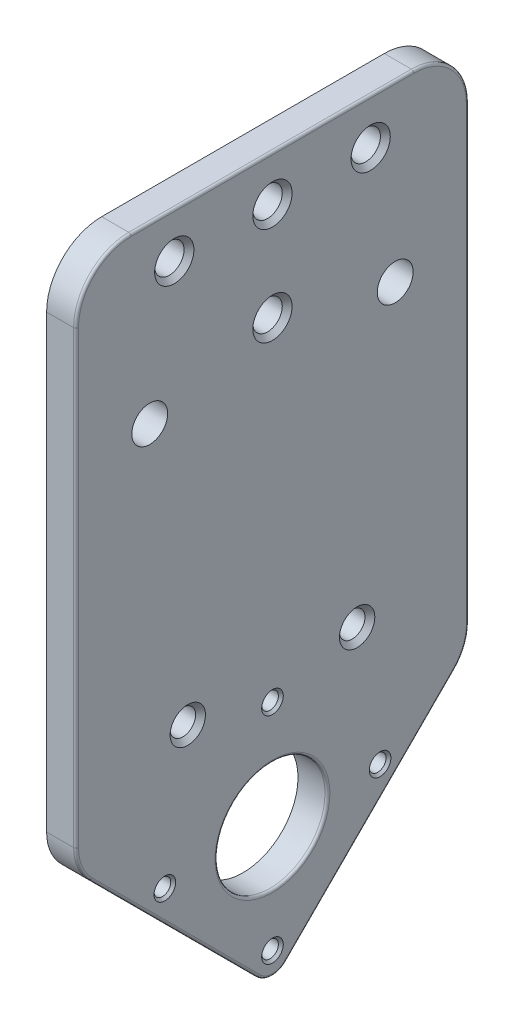
from build123d import *

# Parameters (mm, degrees)
SKETCH_2_R      = 1.7
SKETCH_2_R_2    = 2.6
SKETCH_2_R_3    = 11.2
SKETCH_2_R_4    = 3.655
SKETCH_2_R_5    = 3
EXTRUDE_1_DEPTH = 6
CHAMFER_1_SIZE  = 1
CHAMFER_2_SIZE  = 0.5
FILLET_1_R      = 0.5


with BuildPart() as part:
    # Эскиз2 → Бобышка-Вытянуть1 (new body)
    with BuildSketch(Plane(origin=(0, 0, 0), x_dir=(0, 0, -1), z_dir=(1, 0, 0))):
        with BuildLine():
            Line((-28.783294421, 72.542236653), (28.783294421, 72.542236653))
            ThreePointArc((28.783294421, 72.542236653), (36.714702999, 69.256939651), (40, 61.325531074))
            Line((40, 61.325531074), (40, -30.391408151))
            ThreePointArc((40, -30.391408151), (39.238795325, -34.218242474), (37.071067812, -37.462475962))
            Line((37.071067812, -37.462475962), (2.828427125, -71.70511665))
            ThreePointArc((2.828427125, -71.70511665), (0, -72.876689525), (-2.828427125, -71.70511665))
            Line((-2.828427125, -71.70511665), (-37.071067812, -37.462475962))
            ThreePointArc((-37.071067812, -37.462475962), (-39.238795325, -34.218242474), (-40, -30.391408151))
            Line((-40, -30.391408151), (-40, 61.325531074))
            ThreePointArc((-40, 61.325531074), (-36.714702999, 69.256939651), (-28.783294421, 72.542236653))
        make_face()
        with Locations((-21.913410217, -46.3871)):
            Circle(SKETCH_2_R, mode=Mode.SUBTRACT)
        with Locations((17.25, -19.8871)):
            Circle(SKETCH_2_R_2, mode=Mode.SUBTRACT)
        with Locations((-17.25, -19.8871)):
            Circle(SKETCH_2_R_2, mode=Mode.SUBTRACT)
        with Locations((0.0069, -46.3871)):
            Circle(SKETCH_2_R_3, mode=Mode.SUBTRACT)
        with Locations((-25, 37.1129)):
            Circle(SKETCH_2_R_4, mode=Mode.SUBTRACT)
        with Locations((-20, 63.3206)):
            Circle(SKETCH_2_R_5, mode=Mode.SUBTRACT)
        with Locations((0, 63.3206)):
            Circle(SKETCH_2_R_5, mode=Mode.SUBTRACT)
        with Locations((0, 43.3206)):
            Circle(SKETCH_2_R_5, mode=Mode.SUBTRACT)
        with Locations((20, 63.3206)):
            Circle(SKETCH_2_R_5, mode=Mode.SUBTRACT)
        with Locations((25, 37.1129)):
            Circle(SKETCH_2_R_4, mode=Mode.SUBTRACT)
        with Locations((0.0069, -24.466789783)):
            Circle(SKETCH_2_R, mode=Mode.SUBTRACT)
        with Locations((21.927210217, -46.3871)):
            Circle(SKETCH_2_R, mode=Mode.SUBTRACT)
        with Locations((0.0069, -68.307410217)):
            Circle(SKETCH_2_R, mode=Mode.SUBTRACT)
    extrude(amount=EXTRUDE_1_DEPTH)

    # Фаска1
    chamfer_1_edges = [part.edges().sort_by_distance(p)[0] for p in [
        (6, -19.8871, -14.65),
        (6, -19.8871, 19.85),
        (6, 63.3206, 23),
        (6, 63.3206, 3),
        (6, 43.3206, 3),
        (6, 63.3206, -17),
    ]]
    chamfer(chamfer_1_edges, length=CHAMFER_1_SIZE)

    # Фаска2
    chamfer_2_edges = [part.edges().sort_by_distance(p)[0] for p in [
        (6, -24.466789783, 1.6931),
        (6, -46.3871, 23.613410217),
        (6, -46.3871, -20.227210217),
        (6, -68.307410217, 1.6931),
    ]]
    chamfer(chamfer_2_edges, length=CHAMFER_2_SIZE)

    # Скругление1
    fillet_1_edges = [part.edges().sort_by_distance(p)[0] for p in [
        (6, -34.218242474, -39.238795325),
        (6, 15.467061462, -40),
        (6, 69.256939651, -36.714702999),
        (6, 72.542236653, 0),
        (6, 69.256939651, 36.714702999),
        (6, 15.467061462, 40),
        (6, -34.218242474, 39.238795325),
        (6, -54.583796306, 19.949747468),
        (6, -72.876689525, 0),
        (6, -46.3871, 11.1931),
        (6, -54.583796306, -19.949747468),
    ]]
    fillet(fillet_1_edges, radius=FILLET_1_R)


solid = part.part
